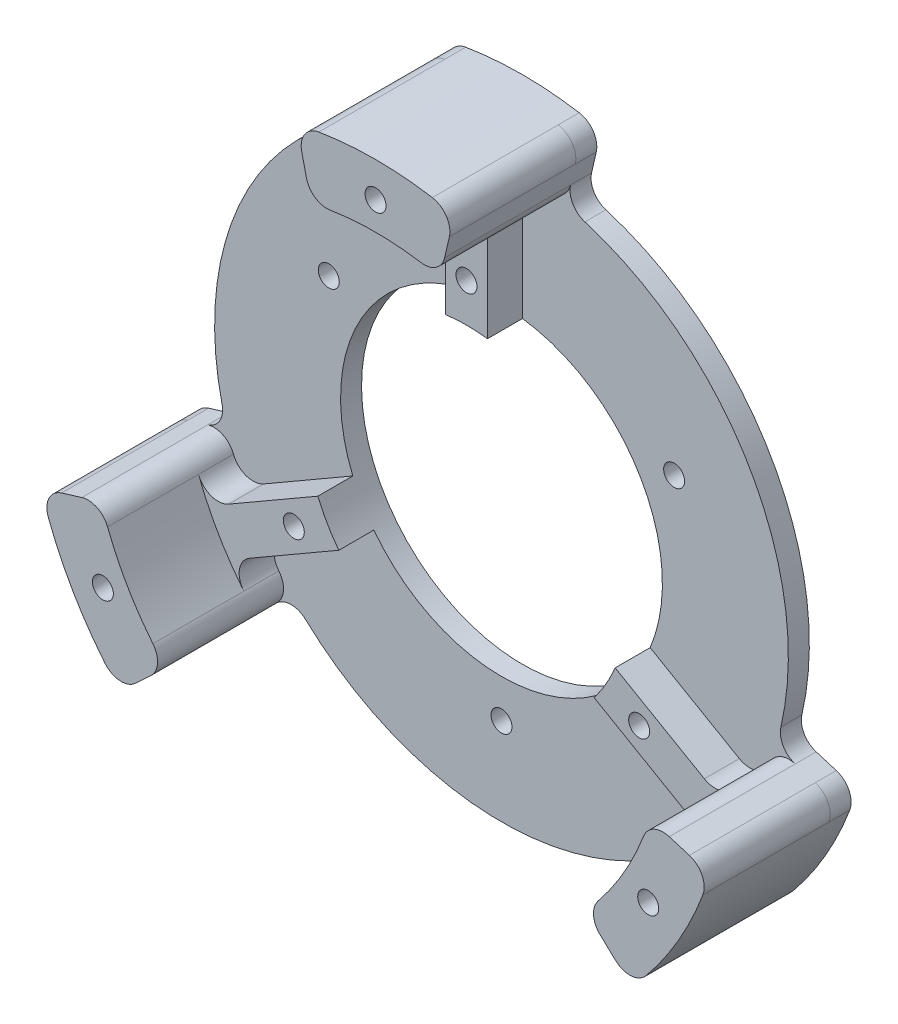
from build123d import *
from build123d.topology import SkipClean

# Parameters (mm, degrees)
SKETCH_1_R          = 50
SKETCH_1_R_2        = 23
EXTRUDE_1_DEPTH     = 3
EXTRUDE_2_DEPTH     = 18
CUT_EXTRUDE_START   = -10
CUT_EXTRUDE_3_DEPTH = 10
FILLET_1_R          = 3
EXTRUDE_3_DEPTH     = 5
FILLET_2_R          = 3
SKETCH_12_R         = 1.5000000000000004
SKETCH_12_R_2       = 1.500000000002469
SKETCH_12_R_3       = 1.500000000003657
SKETCH_12_R_4       = 1.5000000000007194
SKETCH_12_R_5       = 1.5000000000035343
SKETCH_12_R_6       = 1.5000000000057032
SKETCH_12_R_7       = 1.500000000005128
SKETCH_12_R_8       = 1.5000000000024487
CUT_EXTRUDE_5_DEPTH = 72.74880185582359


with BuildPart() as part:
    # 草图1 → 凸台-拉伸1 (new body)
    with BuildSketch(Plane.XY):
        Circle(SKETCH_1_R)
        Circle(SKETCH_1_R_2, mode=Mode.SUBTRACT)
    extrude(amount=EXTRUDE_1_DEPTH)

    # 草图3 → 凸台-拉伸2 (add)
    with SkipClean():  # the faces are left unmerged after this step: merging them gives an invalid solid
        with BuildSketch(Plane.XY.offset(3)):
            with BuildLine():
                Line((-9.874813233208371, 42.77251528270522), (-10.551139704833318, 45.702007077688506))
                ThreePointArc((-10.551139704833318, 45.702007077688506), (-10.120113627064406, 48.04704488795414), (-8.11492501114639, 49.33708536246817))
                ThreePointArc((-8.11492501114639, 49.33708536246817), (1.807e-13, 50.00000000000001), (8.114925011146731, 49.337085362468116))
                ThreePointArc((8.114925011146731, 49.337085362468116), (10.12011362706467, 48.04704488795384), (10.551139704833638, 45.70200707768843))
                Line((10.551139704833638, 45.70200707768843), (9.874813233208666, 42.77251528270517))
                ThreePointArc((9.874813233208666, 42.77251528270517), (8.627318379942658, 40.95893254567728), (6.477723286203897, 40.48504786989108))
                ThreePointArc((6.477723286203897, 40.48504786989108), (1.2996e-13, 41), (-6.477723286203645, 40.48504786989111))
                ThreePointArc((-6.477723286203645, 40.48504786989111), (-8.62731837994238, 40.95893254567734), (-9.874813233208371, 42.77251528270522))
            make_face()
            with BuildLine():
                Line((41.97949143518492, -12.834418523767924), (44.854668985630965, -13.71344851558049))
                ThreePointArc((44.854668985630965, -13.71344851558049), (46.67001826327145, -15.259246953754747), (46.784631778151805, -17.640811471776157))
                ThreePointArc((46.784631778151805, -17.640811471776157), (43.301270189221555, -25.00000000000067), (38.669706767005025, -31.696273890693295))
                ThreePointArc((38.669706767005025, -31.696273890693295), (36.549904636206634, -32.78779793420051), (34.30352928079721, -31.988558562109187))
                Line((34.30352928079721, -31.988558562109187), (32.10467820197613, -29.938096758938418))
                ThreePointArc((32.10467820197613, -29.938096758938418), (31.157816906477983, -27.9509431564057), (31.822218285652507, -25.85239685948451))
                ThreePointArc((31.822218285652507, -25.85239685948451), (35.507041555161685, -20.500000000000547), (38.29994157185643, -14.632651010407674))
                ThreePointArc((38.29994157185643, -14.632651010407674), (39.785135286420804, -13.007989389272412), (41.97949143518492, -12.834418523767924))
            make_face()
            with BuildLine():
                Line((-32.10467820197666, -29.93809675893783), (-34.303529280798315, -31.988558562107986))
                ThreePointArc((-34.303529280798315, -31.988558562107986), (-36.54990463620778, -32.78779793419923), (-38.66970676700613, -31.696273890691934))
                ThreePointArc((-38.66970676700613, -31.696273890691934), (-43.30127018922243, -24.99999999999913), (-46.784631778152395, -17.6408114717745))
                ThreePointArc((-46.784631778152395, -17.6408114717745), (-46.67001826327195, -15.259246953753097), (-44.85466898563141, -13.713448515578905))
                Line((-44.85466898563141, -13.713448515578905), (-41.97949143518515, -12.834418523767118))
                ThreePointArc((-41.97949143518515, -12.834418523767118), (-39.78513528642106, -13.00798938927188), (-38.299941571856685, -14.63265101040697))
                ThreePointArc((-38.299941571856685, -14.63265101040697), (-35.50704155516204, -20.499999999999904), (-31.82221828565296, -25.852396859483928))
                ThreePointArc((-31.82221828565296, -25.852396859483928), (-31.157816906478594, -27.950943156405188), (-32.10467820197666, -29.93809675893783))
            make_face()
        extrude(amount=EXTRUDE_2_DEPTH)

    # 草图9 → 切除-拉伸3 (cut)
    with BuildSketch(Plane.XY.offset(3).offset(CUT_EXTRUDE_START)):
        with BuildLine():
            Line((-29.985501766385628, -27.96193276256284), (-36.56768508095982, -34.09991800312355))
            ThreePointArc((-36.56768508095982, -34.09991800312355), (3.06e-15, -50.00000000000001), (36.56768508095982, -34.09991800312355))
            Line((36.56768508095982, -34.09991800312355), (29.985501766385635, -27.96193276256283))
            ThreePointArc((29.985501766385635, -27.96193276256283), (1.161e-14, -41.00000000000001), (-29.985501766385628, -27.96193276256284))
        make_face()
        with BuildLine():
            Line((-9.222993228098813, 39.949172656194584), (-11.247552717191196, 48.718503239262255))
            ThreePointArc((-11.247552717191196, 48.718503239262255), (-43.301270189221846, 25.000000000000213), (-47.815237798151315, -14.618585236138424))
            Line((-47.815237798151315, -14.618585236138424), (-39.208494994484695, -11.987239893631525))
            ThreePointArc((-39.208494994484695, -11.987239893631525), (-35.507041555161905, 20.500000000000185), (-9.222993228098813, 39.949172656194584))
        make_face()
        with BuildLine():
            Line((39.2084949944845, -11.98723989363206), (47.81523779815109, -14.618585236139088))
            ThreePointArc((47.81523779815109, -14.618585236139088), (43.301270189222166, 24.999999999999602), (11.247552717191859, 48.71850323926209))
            Line((11.247552717191859, 48.71850323926209), (9.222993228099345, 39.94917265619444))
            ThreePointArc((9.222993228099345, 39.94917265619444), (35.507041555162175, 20.499999999999673), (39.2084949944845, -11.98723989363206))
        make_face()
    extrude(amount=CUT_EXTRUDE_3_DEPTH, mode=Mode.SUBTRACT)

    # 圆角1
    fillet_1_edges = [part.edges().sort_by_distance(p)[0] for p in [
        (47.81523779815109, -14.618585236139088, 1.5),
        (39.2084949944845, -11.987239893632058, 1.5),
        (9.222993228099345, 39.94917265619444, 1.5),
        (11.247552717191857, 48.71850323926209, 1.5),
        (-11.247552717191198, 48.71850323926226, 1.5),
        (-9.222993228098812, 39.94917265619458, 1.5),
        (-39.208494994484695, -11.987239893631525, 1.5),
        (-47.815237798151315, -14.618585236138426, 1.5),
        (-36.56768508095982, -34.09991800312355, 1.5),
        (-29.98550176638563, -27.96193276256284, 1.5),
        (29.98550176638564, -27.96193276256283, 1.5),
        (36.56768508095982, -34.09991800312355, 1.5),
    ]]
    fillet(fillet_1_edges, radius=FILLET_1_R)

    # 草图10 → 凸台-拉伸3 (add)
    with BuildSketch(Plane.XY.offset(3)):
        with BuildLine():
            Line((-2.9999999999999964, 22.80350850198276), (-2.9999999999999964, 40.89009660052175))
            ThreePointArc((-2.9999999999999964, 40.89009660052175), (2.51e-15, 41.00000000000001), (2.999999999999999, 40.89009660052175))
            Line((2.999999999999999, 40.89009660052175), (3.0000000000000044, 22.80350850198276))
            ThreePointArc((3.0000000000000044, 22.80350850198276), (1.41e-15, 23), (-2.9999999999999964, 22.80350850198276))
        make_face()
        with BuildLine():
            Line((21.248417658131462, -8.80367803963817), (36.91186241925147, -17.846972088907737))
            ThreePointArc((36.91186241925147, -17.846972088907737), (35.50704155516189, -20.50000000000017), (33.91186241925145, -23.04312451161435))
            Line((33.91186241925145, -23.04312451161435), (18.248417658131434, -13.99983046234479))
            ThreePointArc((18.248417658131434, -13.99983046234479), (19.918584287042034, -11.500000000000101), (21.248417658131462, -8.80367803963817))
        make_face()
        with BuildLine():
            Line((-18.24841765813163, -13.999830462344521), (-33.91186241925177, -23.043124511613875))
            ThreePointArc((-33.91186241925177, -23.043124511613875), (-35.507041555162175, -20.499999999999666), (-36.91186241925171, -17.84697208890722))
            Line((-36.91186241925171, -17.84697208890722), (-21.24841765813158, -8.80367803963786))
            ThreePointArc((-21.24841765813158, -8.80367803963786), (-19.918584287042194, -11.499999999999812), (-18.24841765813163, -13.999830462344521))
        make_face()
    extrude(amount=EXTRUDE_3_DEPTH)

    # 圆角2
    fillet_2_edges = [part.edges().sort_by_distance(p)[0] for p in [
        (2.999999999999999, 40.89009660052176, 5.5),
        (-2.9999999999999964, 40.89009660052176, 5.5),
        (33.91186241925145, -23.04312451161435, 5.5),
        (36.91186241925147, -17.846972088907737, 5.5),
        (-36.91186241925171, -17.846972088907222, 5.5),
        (-33.911862419251776, -23.043124511613875, 5.5),
    ]]
    fillet(fillet_2_edges, radius=FILLET_2_R)

    # 草图12 → 切除-拉伸5 (cut, through all)
    with BuildSketch(Plane(origin=(0, 0, 0), x_dir=(-1, 0, 0), z_dir=(0, 0, -1))):
        with Locations((0, 45.00000000000001)):
            Circle(SKETCH_12_R)
        with Locations((0, 28.5)):
            Circle(SKETCH_12_R)
        with Locations((38.97114317030261, -22.49999999999833)):
            Circle(SKETCH_12_R_2)
        with Locations((-38.97114317029686, -22.500000000001673)):
            Circle(SKETCH_12_R_3)
        with Locations((24.681724007857937, 14.250000000002501)):
            Circle(SKETCH_12_R_4)
        with Locations((24.681724007860826, -14.2499999999975)):
            Circle(SKETCH_12_R_5)
        with Locations((5.7644e-12, -28.5)):
            Circle(SKETCH_12_R_6)
        with Locations((-24.681724007852175, -14.250000000002506)):
            Circle(SKETCH_12_R_7)
        with Locations((-24.681724007855074, 14.249999999997485)):
            Circle(SKETCH_12_R_8)
    extrude(amount=-CUT_EXTRUDE_5_DEPTH, mode=Mode.SUBTRACT)


solid = part.part
